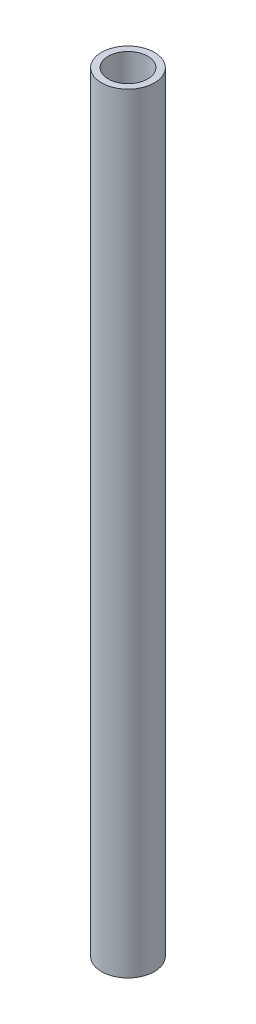
from build123d import *

# Parameters (mm, degrees)
SKETCH1_R           = 3.95
SKETCH1_R_2         = 2.95
BOSS_EXTRUDE1_DEPTH = 115


with BuildPart() as part:
    # Sketch1 → Boss-Extrude1 (new body)
    with BuildSketch(Plane(origin=(0, 0, 0), x_dir=(1, 0, 0), z_dir=(0, 1, 0))):
        with Locations(Location((0, 0, 0), (0, 0, 270))):
            Circle(SKETCH1_R)
        with Locations(Location((0, 0, 0), (0, 0, 270))):
            Circle(SKETCH1_R_2, mode=Mode.SUBTRACT)
    extrude(amount=BOSS_EXTRUDE1_DEPTH)


solid = part.part
